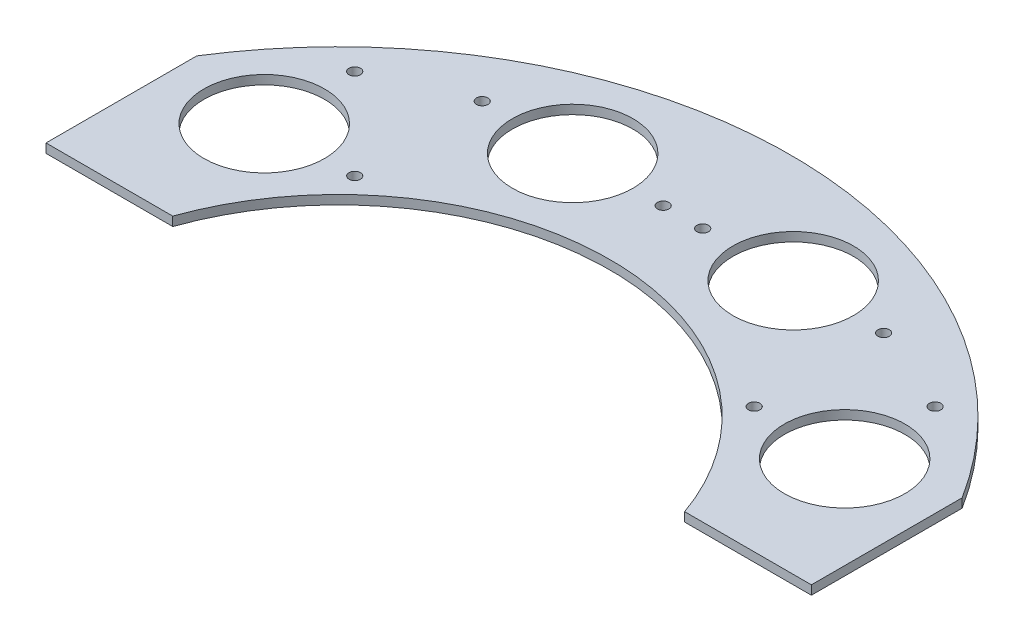
from build123d import *

# Parameters (mm, degrees)
SKETCH3_R              = 20
BOSS_EXTRUDE3_DEPTH    = 3
F_10_24_TAPPED_HOLE1_D = 3.7973


with BuildPart() as part:
    # Sketch3 → Boss-Extrude3 (new body)
    with BuildSketch(Plane(origin=(0, 0, 0), x_dir=(1, 0, 0), z_dir=(0, 1, 0))):
        with BuildLine():
            Line((-126.885775404, -16.789832489), (-84.87168845, -16.789832489))
            ThreePointArc((-84.87168845, -16.789832489), (0, 43.227962976), (84.87168845, -16.789832489))
            Line((84.87168845, -16.789832489), (126.885775404, -16.789832489))
            Line((126.885775404, -16.789832489), (126.885775404, 33.210167511))
            ThreePointArc((126.885775404, 33.210167511), (0, 103.210167511), (-126.885775404, 33.210167511))
            Line((-126.885775404, 33.210167511), (-126.885775404, -16.789832489))
        make_face()
        with Locations(Location((-36.555626875, 67.506651026, 0), (0, 0, 270))):
            Circle(SKETCH3_R, mode=Mode.SUBTRACT)
        with Locations(Location((-96.223855306, 24.910723088, 0), (0, 0, 270))):
            Circle(SKETCH3_R, mode=Mode.SUBTRACT)
        with Locations(Location((36.555626875, 67.506651026, 0), (0, 0, 270))):
            Circle(SKETCH3_R, mode=Mode.SUBTRACT)
        with Locations(Location((96.223855306, 24.910723088, 0), (0, 0, 270))):
            Circle(SKETCH3_R, mode=Mode.SUBTRACT)
    extrude(amount=BOSS_EXTRUDE3_DEPTH)

    # #10-24 Tapped Hole1 (through all)
    with Locations(Plane(origin=(0, 3, 0), x_dir=(1, 0, 0), z_dir=(0, 1, 0))):
        with Locations((-66.223855306, 24.910723088), (-96.223855306, 54.910723088), (-66.555626875, 67.506651026), (-6.555626875, 67.506651026), (6.555626875, 67.506651026), (66.555626875, 67.506651026), (96.223855306, 54.910723088), (66.223855306, 24.910723088)):
            Hole(F_10_24_TAPPED_HOLE1_D / 2)


solid = part.part
